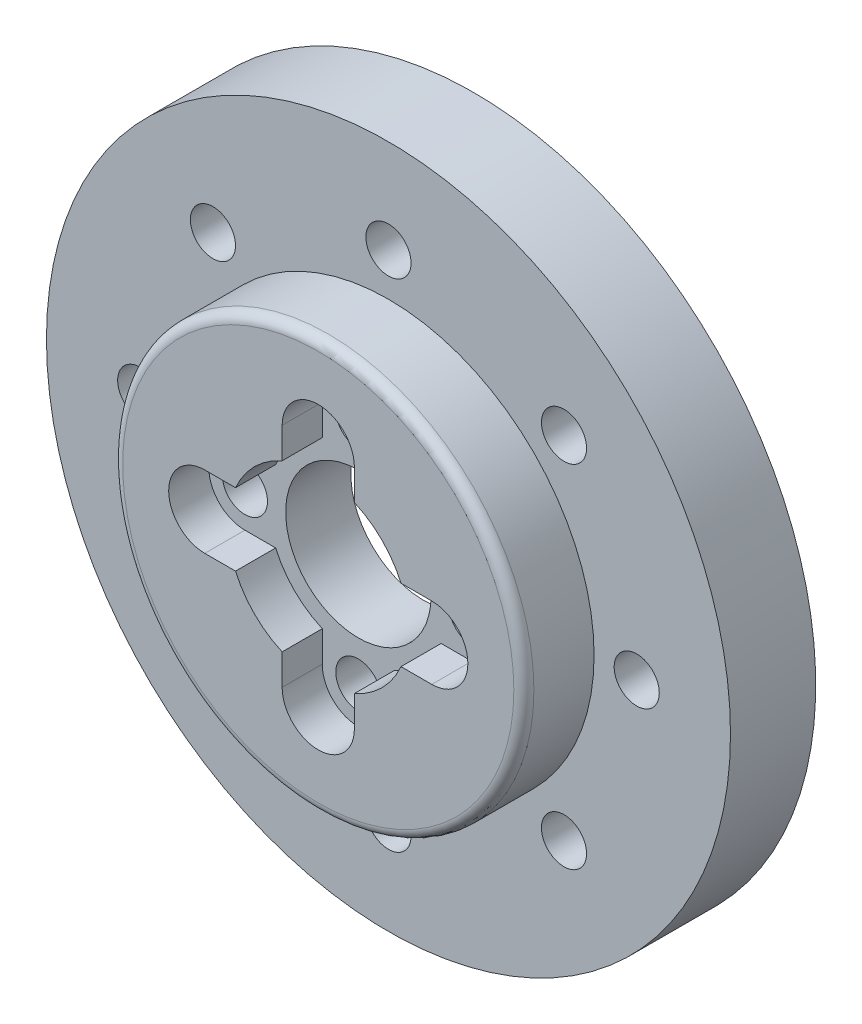
from build123d import *
from build123d.topology import SkipClean

# Parameters (mm, degrees)
SKETCH1_R               = 34.1
BOSS_EXTRUDE1_DEPTH     = 1.75
SKETCH4_R               = 28.5
BOSS_EXTRUDE2_DEPTH     = 2
SKETCH5_R               = 34.1
SKETCH5_R_2             = 16.25
BOSS_EXTRUDE3_DEPTH     = 5
CUT_EXTRUDE2_DEPTH      = 49.968050809
CUT_EXTRUDE2_DEPTH_BACK = 49.968050809
SKETCH3_R               = 2.25
CUT_EXTRUDE1_DEPTH      = 49.968050809
CUT_EXTRUDE1_DEPTH_BACK = 49.968050809
SKETCH2_R               = 7.25
SKETCH6_R               = 2.25
CUT_EXTRUDE3_DEPTH      = 50.354533733
CIRPATTERN1_COUNT       = 8
SKETCH7_R               = 20.5
SKETCH7_R_2             = 2.25
SKETCH7_R_3             = 7.25
BOSS_EXTRUDE4_DEPTH     = 5
BOSS_EXTRUDE5_START     = 2
SKETCH8_R               = 34.1
SKETCH8_R_2             = 28.5
BOSS_EXTRUDE5_DEPTH     = 2
SKETCH10_R              = 34.1
SKETCH10_R_2            = 20.5
CUT_EXTRUDE4_DEPTH      = 2
CUT_EXTRUDE5_DEPTH      = 4
SKETCH12_R              = 4.6
CUT_EXTRUDE6_DEPTH      = 3
FILLET2_R               = 1


with BuildPart() as part:
    # Sketch1 → Boss-Extrude1 (new, symmetric)
    with BuildSketch(Plane.XY):
        Circle(SKETCH1_R)
    extrude(amount=BOSS_EXTRUDE1_DEPTH, both=True)

    # Sketch4 → Boss-Extrude2 (add)
    with BuildSketch(Plane.XY.offset(1.75)):
        Circle(SKETCH4_R)
    extrude(amount=BOSS_EXTRUDE2_DEPTH)

    # Sketch5 → Boss-Extrude3 (add)
    with BuildSketch(Plane(origin=(0, 0, -1.75), x_dir=(-1, 0, 0), z_dir=(0, 0, -1))):
        Circle(SKETCH5_R)
        Circle(SKETCH5_R_2, mode=Mode.SUBTRACT)
    extrude(amount=BOSS_EXTRUDE3_DEPTH)

    # Sketch3 → Cut-Extrude2 (cut, two sides: drawn at the far end of the back side and taken through both)
    with BuildSketch(Plane.XY.offset(1.75).offset(-CUT_EXTRUDE2_DEPTH_BACK)):
        with Locations((0, 11.3137085)):
            Circle(SKETCH3_R)
        with Locations((11.3137085, 0)):
            Circle(SKETCH3_R)
        with Locations((0, -11.3137085)):
            Circle(SKETCH3_R)
        with Locations((-11.3137085, 0)):
            Circle(SKETCH3_R)
    extrude(amount=CUT_EXTRUDE2_DEPTH + CUT_EXTRUDE2_DEPTH_BACK, mode=Mode.SUBTRACT)

    # Sketch2 → Cut-Extrude1 (cut, two sides: drawn at the far end of the back side and taken through both)
    with BuildSketch(Plane.XY.offset(1.75).offset(-CUT_EXTRUDE1_DEPTH_BACK)):
        Circle(SKETCH2_R)
    extrude(amount=CUT_EXTRUDE1_DEPTH + CUT_EXTRUDE1_DEPTH_BACK, mode=Mode.SUBTRACT)

    # Sketch6 → Cut-Extrude3 (cut, symmetric)
    with BuildSketch(Plane.XY.offset(3.75)):
        with Locations((0, 24.75)):
            Circle(SKETCH6_R)
    cut_extrude3 = extrude(amount=CUT_EXTRUDE3_DEPTH, both=True, mode=Mode.SUBTRACT)

    # CirPattern1: Cut-Extrude3 ×8 about axis
    cirpattern1_axis = Axis((0, 0, 0), (0, 0, 1))
    for i in range(1, CIRPATTERN1_COUNT):
        add(cut_extrude3.rotate(cirpattern1_axis, i * 360 / CIRPATTERN1_COUNT), mode=Mode.SUBTRACT)

    # Sketch7 → Boss-Extrude4 (add)
    with BuildSketch(Plane.XY.offset(3.75)):
        Circle(SKETCH7_R)
        with Locations((0, -11.3137085)):
            Circle(SKETCH7_R_2, mode=Mode.SUBTRACT)
        with Locations((11.3137085, 0)):
            Circle(SKETCH7_R_2, mode=Mode.SUBTRACT)
        with Locations((0, 11.3137085)):
            Circle(SKETCH7_R_2, mode=Mode.SUBTRACT)
        with Locations((-11.3137085, 0)):
            Circle(SKETCH7_R_2, mode=Mode.SUBTRACT)
        Circle(SKETCH7_R_3, mode=Mode.SUBTRACT)
    extrude(amount=BOSS_EXTRUDE4_DEPTH)

    # Sketch8 → Boss-Extrude5 (add)
    with SkipClean():  # the faces are left unmerged after this step: merging them gives an invalid solid
        with BuildSketch(Plane.XY.offset(1.75).offset(BOSS_EXTRUDE5_START)):
            with Locations(Location((0, 0, 0), (0, 0, 180))):
                Circle(SKETCH8_R)
            Circle(SKETCH8_R_2, mode=Mode.SUBTRACT)
        extrude(amount=-BOSS_EXTRUDE5_DEPTH)

    # Sketch10 → Cut-Extrude4 (cut)
    with BuildSketch(Plane.XY.offset(3.75)):
        with Locations(Location((0, 0, 0), (0, 0, 180))):
            Circle(SKETCH10_R)
        Circle(SKETCH10_R_2, mode=Mode.SUBTRACT)
    extrude(amount=-CUT_EXTRUDE4_DEPTH, mode=Mode.SUBTRACT)

    # Sketch11 → Cut-Extrude5 (cut)
    with BuildSketch(Plane.XY.offset(8.75)):
        with BuildLine():
            Line((-11.3137085, 3.6), (-8.248636251, 3.6))
            ThreePointArc((-8.248636251, 3.6), (-6.363961031, 6.363961031), (-3.6, 8.248636251))
            Line((-3.6, 8.248636251), (-3.6, 11.3137085))
            ThreePointArc((-3.6, 11.3137085), (0, 14.9137085), (3.6, 11.3137085))
            Line((3.6, 11.3137085), (3.6, 8.248636251))
            ThreePointArc((3.6, 8.248636251), (6.363961031, 6.363961031), (8.248636251, 3.6))
            Line((8.248636251, 3.6), (11.3137085, 3.6))
            ThreePointArc((11.3137085, 3.6), (14.9137085, 0), (11.3137085, -3.6))
            Line((11.3137085, -3.6), (8.248636251, -3.6))
            ThreePointArc((8.248636251, -3.6), (6.363961031, -6.363961031), (3.6, -8.248636251))
            Line((3.6, -8.248636251), (3.6, -11.3137085))
            ThreePointArc((3.6, -11.3137085), (0, -14.9137085), (-3.6, -11.3137085))
            Line((-3.6, -11.3137085), (-3.6, -8.248636251))
            ThreePointArc((-3.6, -8.248636251), (-6.363961031, -6.363961031), (-8.248636251, -3.6))
            Line((-8.248636251, -3.6), (-11.3137085, -3.6))
            ThreePointArc((-11.3137085, -3.6), (-14.9137085, 0), (-11.3137085, 3.6))
        make_face()
    extrude(amount=-CUT_EXTRUDE5_DEPTH, mode=Mode.SUBTRACT)

    # Sketch12 → Cut-Extrude6 (cut)
    with BuildSketch(Plane(origin=(0, 0, -6.75), x_dir=(-1, 0, 0), z_dir=(0, 0, -1))):
        with Locations((0, 24.75)):
            Circle(SKETCH12_R)
        with Locations((17.500892834, 17.500892834)):
            Circle(SKETCH12_R)
        with Locations((24.75, 0)):
            Circle(SKETCH12_R)
        with Locations((17.500892834, -17.500892834)):
            Circle(SKETCH12_R)
        with Locations((0, -24.75)):
            Circle(SKETCH12_R)
        with Locations((-17.500892834, -17.500892834)):
            Circle(SKETCH12_R)
        with Locations((-24.75, 0)):
            Circle(SKETCH12_R)
        with Locations((-17.500892834, 17.500892834)):
            Circle(SKETCH12_R)
    extrude(amount=-CUT_EXTRUDE6_DEPTH, mode=Mode.SUBTRACT)

    # Fillet2
    fillet2_edges = [part.edges().sort_by_distance(p)[0] for p in [
        (-20.5, 0, 8.75),
    ]]
    fillet(fillet2_edges, radius=FILLET2_R)


solid = part.part
